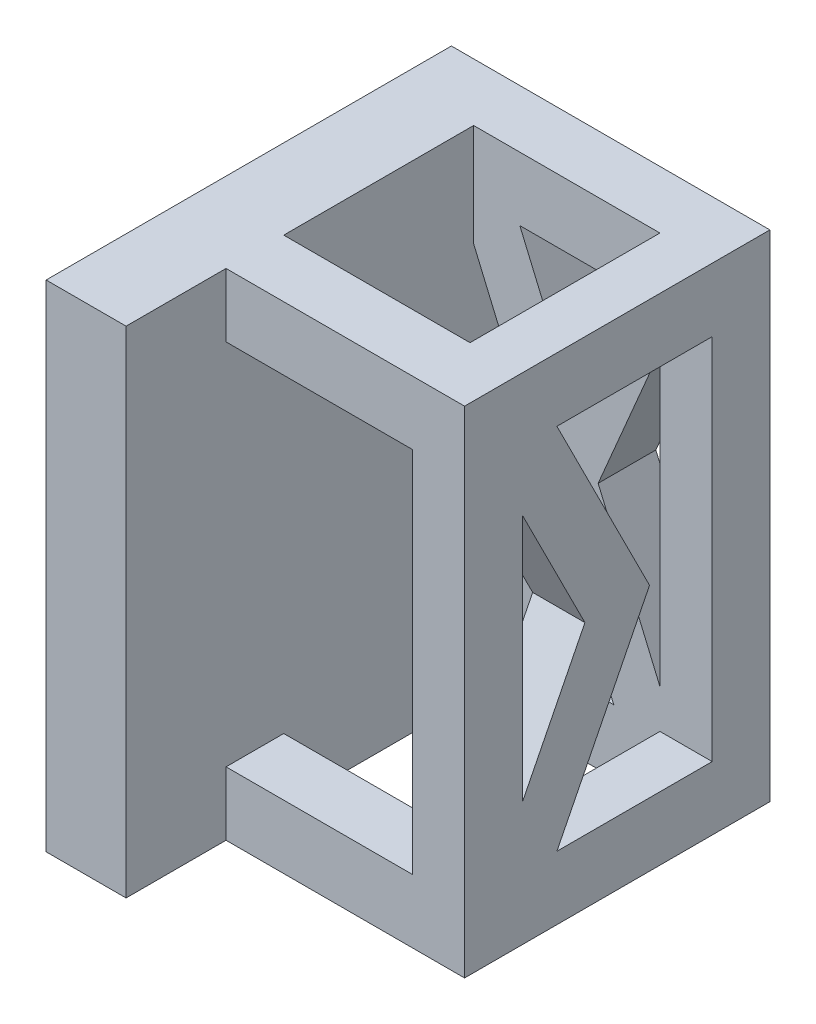
from build123d import *

# Parameters (mm, degrees)
BOSS_EXTRUDE2_DEPTH      = 0.25
BOSS_EXTRUDE2_DEPTH_BACK = 38
SKETCH1_W                = 8.8
SKETCH1_H                = 54.5
BOSS_EXTRUDE3_DEPTH      = 6.35
SKETCH3_W                = 5.75
SKETCH3_H                = 54.5
BOSS_EXTRUDE4_DEPTH      = 6.35
BOSS_EXTRUDE5_DEPTH      = 5.75


with BuildPart() as part:
    # Sketch1 → Boss-Extrude2 (new, two sides: drawn at the far end of the back side and taken through both)
    with BuildSketch(Plane(origin=(0, 0, -77.8375), x_dir=(-1, 0, 0), z_dir=(0, 0, -1)).offset(-BOSS_EXTRUDE2_DEPTH_BACK)):
        with Locations((14.65, 10)):
            Rectangle(SKETCH1_W, SKETCH1_H)
    extrude(amount=BOSS_EXTRUDE2_DEPTH + BOSS_EXTRUDE2_DEPTH_BACK)

    # Sketch2 → Boss-Extrude3 (add)
    with BuildSketch(Plane(origin=(0, 0, -50.8375), x_dir=(-1, 0, 0), z_dir=(0, 0, -1))):
        Polygon((10.25, -17.25), (10.25, -10.25), (-10.25, -10.25), (-10.25, 30.25), (10.25, 30.25), (10.25, 37.25), (-16, 37.25), (-16, -17.25), align=None)
    extrude(amount=BOSS_EXTRUDE3_DEPTH)

    # Sketch3 → Boss-Extrude4 (add)
    with BuildSketch(Plane(origin=(0, 0, -78.0875), x_dir=(-1, 0, 0), z_dir=(0, 0, -1))):
        Polygon((10.25, 30.25), (10.25, 37.25), (-10.25, 37.25), (-10.25, 30.25), (-5.17, 30.25), (5.17, 30.25), align=None)
        with Locations((-13.125, 10)):
            Rectangle(SKETCH3_W, SKETCH3_H)
        Polygon((19.05, -17.25), (19.05, 37.25), (10.25, 37.25), (10.25, 30.25), (10.25, 25.971389376), (10.25, -5.971389376), (10.25, -10.25), (10.25, -17.25), align=None)
        Polygon((10.25, 25.971389376), (10.25, 30.25), (5.17, 30.25), (0, 18.105733912), (3.450735024, 10), align=None)
        Polygon((-5.17, 30.25), (-10.25, 30.25), (-10.25, 25.971389376), (-3.450735024, 10), (0, 18.105733912), align=None)
        Polygon((0, 1.894266088), (3.450735024, 10), (0, 18.105733912), (-3.450735024, 10), align=None)
        Polygon((-10.25, -5.971389376), (-10.25, -10.25), (-5.17, -10.25), (0, 1.894266088), (-3.450735024, 10), align=None)
        Polygon((5.17, -10.25), (10.25, -10.25), (10.25, -5.971389376), (3.450735024, 10), (0, 1.894266088), align=None)
        Polygon((-10.25, -17.25), (10.25, -17.25), (10.25, -10.25), (5.17, -10.25), (-5.17, -10.25), (-10.25, -10.25), align=None)
    extrude(amount=BOSS_EXTRUDE4_DEPTH)

    # Sketch4 → Boss-Extrude5 (add)
    with BuildSketch(Plane(origin=(16, 0, 0), x_dir=(0, 0, -1), z_dir=(1, 0, 0))):
        Polygon((67.6375, 2.939263745), (64.082844513, 10), (57.1875, -3.696463464), (57.1875, -10.25), (60.9975, -10.25), align=None)
        Polygon((60.9975, -10.25), (57.1875, -10.25), (57.1875, -17.25), (78.0875, -17.25), (78.0875, -10.25), (74.2775, -10.25), align=None)
        Polygon((71.192155487, 10), (67.6375, 17.060736255), (64.082844513, 10), (67.6375, 2.939263745), align=None)
        Polygon((78.0875, 37.25), (57.1875, 37.25), (57.1875, 30.25), (60.9975, 30.25), (74.2775, 30.25), (78.0875, 30.25), align=None)
        Polygon((60.9975, 30.25), (57.1875, 30.25), (57.1875, 23.696463464), (64.082844513, 10), (67.6375, 17.060736255), align=None)
    extrude(amount=-BOSS_EXTRUDE5_DEPTH)


solid = part.part
